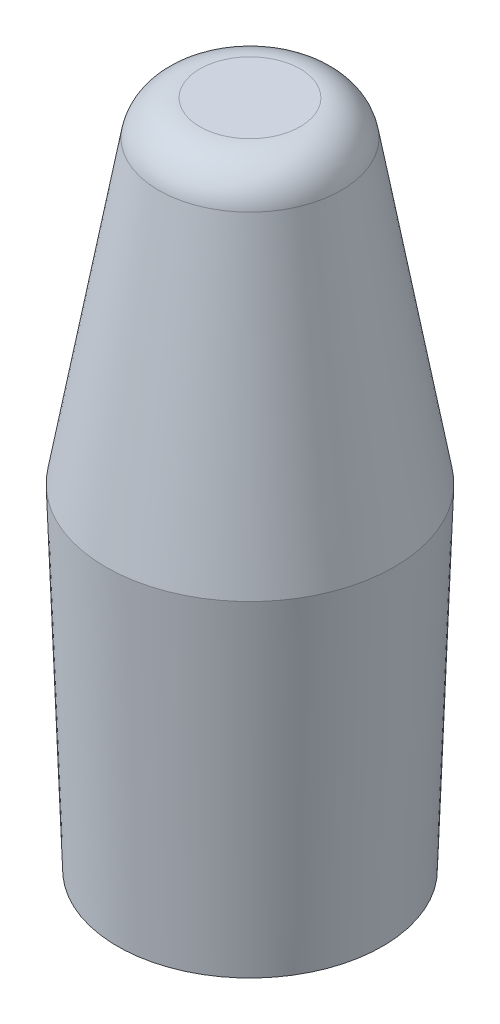
from build123d import *

# Parameters (mm, degrees)
SKETCH1_R           = 1.725
BOSS_EXTRUDE1_DEPTH = 4
BOSS_EXTRUDE1_TAPER = 10
SKETCH2_R           = 1.725
BOSS_EXTRUDE2_DEPTH = 4
BOSS_EXTRUDE2_TAPER = 2
FILLET5_R           = 0.5


with BuildPart() as part:
    # Sketch1 → Boss-Extrude1 (new body)
    with BuildSketch(Plane(origin=(0, 0, 0), x_dir=(1, 0, 0), z_dir=(0, 1, 0))):
        Circle(SKETCH1_R)
    extrude(amount=BOSS_EXTRUDE1_DEPTH, taper=BOSS_EXTRUDE1_TAPER)

    # Fillet5
    fillet5_edges = [part.edges().sort_by_distance(p)[0] for p in [
        (-1.019692077, 4, 0),
    ]]
    fillet(fillet5_edges, radius=FILLET5_R)


with BuildPart() as body_2:
    # Sketch2 → Boss-Extrude2 (new body)
    with BuildSketch(Plane.XZ):
        Circle(SKETCH2_R)
    extrude(amount=BOSS_EXTRUDE2_DEPTH, taper=BOSS_EXTRUDE2_TAPER)


solid = Compound([part.part, body_2.part])
